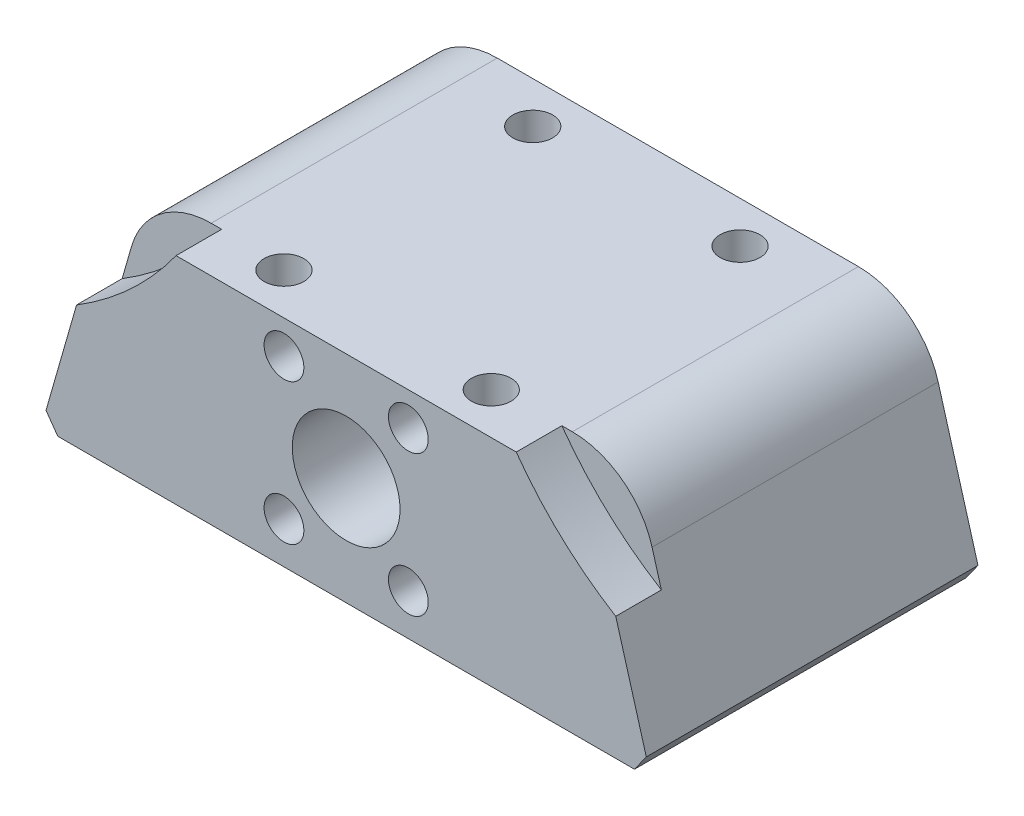
from build123d import *

# Parameters (mm, degrees)
SKETCH_1_R          = 2.4
SKETCH_1_R_2        = 6.5
EXTRUDE_1_DEPTH     = 40
FILLET_1_R          = 10
SKETCH_2_R          = 2.4
CUT_EXTRUDE_1_DEPTH = 66.0828238
SKETCH_4_R          = 41.2
CUT_EXTRUDE_2_DEPTH = 5.5
CUT_EXTRUDE_3_DEPTH = 64.25167155


with BuildPart() as part:
    # 草图1 → 凸台-拉伸1 (new body)
    with BuildSketch(Plane.XY):
        Polygon((-29.269334238, -5), (44.269334238, -5), (36.813954208, 21), (-21.813954208, 21), align=None)
        with Locations((15, 17)):
            Circle(SKETCH_1_R, mode=Mode.SUBTRACT)
        with Locations((15, 0)):
            Circle(SKETCH_1_R, mode=Mode.SUBTRACT)
        Circle(SKETCH_1_R, mode=Mode.SUBTRACT)
        with Locations((0, 17)):
            Circle(SKETCH_1_R, mode=Mode.SUBTRACT)
        with Locations((7.5, 8)):
            Circle(SKETCH_1_R_2, mode=Mode.SUBTRACT)
    extrude(amount=EXTRUDE_1_DEPTH)

    # 圆角1
    fillet_1_edges = [part.edges().sort_by_distance(p)[0] for p in [
        (-21.813954208, 21, 20),
        (36.813954208, 21, 20),
    ]]
    fillet(fillet_1_edges, radius=FILLET_1_R)

    # 草图2 → 切除-拉伸1 (cut, through all)
    with BuildSketch(Plane(origin=(0, 21, 0), x_dir=(1, 0, 0), z_dir=(0, 1, 0))):
        with Locations(Location((-5, -5, 0), (0, 0, 180))):
            Circle(SKETCH_2_R)
        with Locations(Location((20, -5, 0), (0, 0, 180))):
            Circle(SKETCH_2_R)
        with Locations(Location((-5, -35, 0), (0, 0, 180))):
            Circle(SKETCH_2_R)
        with Locations(Location((20, -35, 0), (0, 0, 180))):
            Circle(SKETCH_2_R)
    extrude(amount=-CUT_EXTRUDE_1_DEPTH, mode=Mode.SUBTRACT)

    # 草图4 → 切除-拉伸2 (cut)
    with BuildSketch(Plane.XY.offset(40)):
        with Locations((-46.5, 45)):
            Circle(SKETCH_4_R)
        with Locations((61.5, 45)):
            Circle(SKETCH_4_R)
    extrude(amount=-CUT_EXTRUDE_2_DEPTH, mode=Mode.SUBTRACT)

    # 草图5 → 切除-拉伸3 (cut, through all)
    with BuildSketch(Plane(origin=(0, 0, 0), x_dir=(-1, 0, 0), z_dir=(0, 0, -1))):
        Polygon((-42.269334238, -5), (-44.269334238, -5), (-43.695843466, -3), align=None)
        Polygon((28.695843466, -3), (27.269334238, -5), (29.269334238, -5), align=None)
    extrude(amount=-CUT_EXTRUDE_3_DEPTH, mode=Mode.SUBTRACT)


solid = part.part
